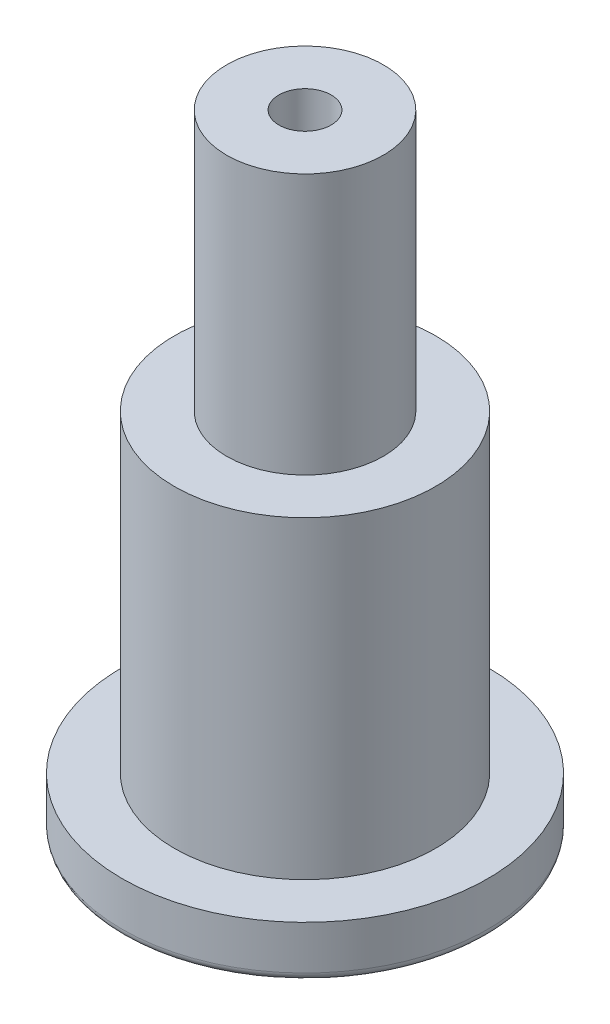
from build123d import *

# Parameters (mm, degrees)
SKETCH1_R           = 5.55625
BOSS_EXTRUDE1_DEPTH = 1.5875
SKETCH2_R           = 3.96875
BOSS_EXTRUDE2_DEPTH = 9.525
SKETCH3_R           = 2.38125
SKETCH3_R_2         = 0.79375
EXTRUDE_THIN2_DEPTH = 7.9248
FILLET1_R           = 0.254


with BuildPart() as part:
    # Sketch1 → Boss-Extrude1 (new body)
    with BuildSketch(Plane(origin=(0, 0, 0), x_dir=(1, 0, 0), z_dir=(0, 1, 0))):
        Circle(SKETCH1_R)
    extrude(amount=BOSS_EXTRUDE1_DEPTH)

    # Sketch2 → Boss-Extrude2 (add)
    with BuildSketch(Plane(origin=(0, 1.5875, 0), x_dir=(1, 0, 0), z_dir=(0, 1, 0))):
        Circle(SKETCH2_R)
    extrude(amount=BOSS_EXTRUDE2_DEPTH)

    # Sketch3 → Extrude-Thin2 (add)
    with BuildSketch(Plane(origin=(0, 11.1125, 0), x_dir=(1, 0, 0), z_dir=(0, 1, 0))):
        Circle(SKETCH3_R)
        Circle(SKETCH3_R_2, mode=Mode.SUBTRACT)
    extrude(amount=EXTRUDE_THIN2_DEPTH)

    # Fillet1
    fillet1_edges = [part.edges().sort_by_distance(p)[0] for p in [
        (-5.55625, 0, 0),
    ]]
    fillet(fillet1_edges, radius=FILLET1_R)


solid = part.part
